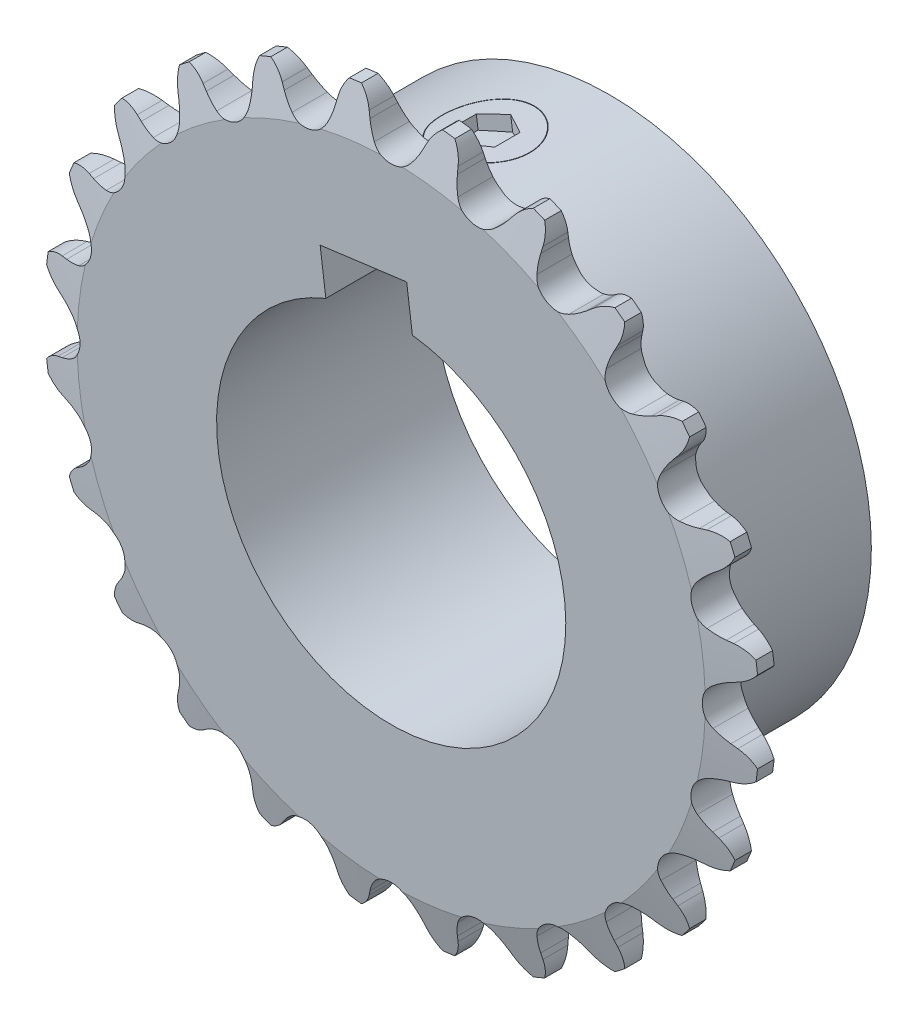
from build123d import *

# Parameters (mm, degrees)
TOOTH_CUT_NUMBER_OF_TEETH_24_DEPTH = 37.826492409
TOOTH_PATTERN_24_24_COUNT          = 24
SKETCH3_W                          = 13.081
SKETCH3_H                          = 19.05
SKETCH4_R                          = 12.7
CUT_EXTRUDE1_DEPTH                 = 40.859801219
CUT_EXTRUDE2_DEPTH                 = 40.859801219
SKETCH7_R                          = 3.175
CUT_EXTRUDE3_DEPTH                 = 52.800976971
CUT_EXTRUDE3_DRAFT                 = 1
EXTRUDE1_REACH                     = 53.801
EXTRUDE1_END_RADIUS                = 19.05
SKETCH8_R                          = 3.20381845
CUT_EXTRUDE4_START                 = -2.54
CUT_EXTRUDE4_DEPTH                 = 50.260976999


with BuildPart() as part:
    # Sprocket-BaseSketch → 25 (04C) ANSI (ISO) Chain Number, 1.915in P.D. (revolve)
    with BuildSketch(Plane(origin=(0, 0, 0), x_dir=(0, 0, -1), z_dir=(1, 0, 0))):
        Polygon((1.397, 0), (1.397, 22.846519308), (0.60325, 26.021519308), (-0.60325, 26.021519308), (-1.397, 22.846519308), (-1.397, 0), align=None)
    revolve(axis=Axis((0, 0, -5.588), (0, 0, 1)))

    # Tooth-Sketch → Tooth-Cut, Number of teeth: 24 (cut, symmetric)
    with BuildSketch(Plane.XY):
        with BuildLine():
            Line((1.931997911, 24.319032161), (2.092325349, 24.719204009))
            ThreePointArc((2.092325349, 24.719204009), (3.079474662, 25.94368443), (4.583251305, 26.404631149))
            ThreePointArc((4.583251305, 26.404631149), (0, 26.799454074), (-4.583251305, 26.404631149))
            ThreePointArc((-4.583251305, 26.404631149), (-3.079474662, 25.94368443), (-2.092325349, 24.719204009))
            Line((-2.092325349, 24.719204009), (-1.931997911, 24.319032161))
            ThreePointArc((-1.931997911, 24.319032161), (-1.674480918, 23.785144178), (-1.346602259, 23.291335547))
            ThreePointArc((-1.346602259, 23.291335547), (0, 22.627264802), (1.346602259, 23.291335547))
            ThreePointArc((1.346602259, 23.291335547), (1.674480918, 23.785144178), (1.931997911, 24.319032161))
        make_face()
    tooth_cut_number_of_teeth_24 = extrude(amount=TOOTH_CUT_NUMBER_OF_TEETH_24_DEPTH, both=True, mode=Mode.SUBTRACT)

    # Tooth Pattern, 24 / 24: Tooth-Cut, Number of teeth: 24 ×24 about axis
    tooth_pattern_24_24_axis = Axis((0, 0, -88.99), (0, 0, 1))
    for i in range(1, TOOTH_PATTERN_24_24_COUNT):
        add(tooth_cut_number_of_teeth_24.rotate(tooth_pattern_24_24_axis, i * 360 / TOOTH_PATTERN_24_24_COUNT), mode=Mode.SUBTRACT)

    # Sketch3 → Hub-Revolve1 (revolve)
    with BuildSketch(Plane(origin=(0, 0, 0), x_dir=(0, 0, -1), z_dir=(1, 0, 0))):
        with Locations((7.9375, 9.525)):
            Rectangle(SKETCH3_W, SKETCH3_H)
    revolve(axis=Axis((0, 0, 13.081), (0, 0, -1)))

    # Sketch4 → Cut-Extrude1 (cut, through all)
    with BuildSketch(Plane(origin=(0, 0, -14.478), x_dir=(-1, 0, 0), z_dir=(0, 0, -1))):
        Circle(SKETCH4_R)
    extrude(amount=-CUT_EXTRUDE1_DEPTH, mode=Mode.SUBTRACT)

    # Sketch6 → Cut-Extrude2 (cut, through all)
    with BuildSketch(Plane(origin=(0, 0, -14.478), x_dir=(-1, 0, 0), z_dir=(0, 0, -1))):
        Polygon((-1.542793119, 12.605942622), (-1.128372459, 15.753780057), (5.167302411, 14.924938736), (4.752881751, 11.777101301), align=None)
    extrude(amount=-CUT_EXTRUDE2_DEPTH, mode=Mode.SUBTRACT)


with BuildPart() as cut_extrude3_tool:
    # Sketch7 → Cut-Extrude3 (with draft: the straight prism first)
    with BuildSketch(Plane(origin=(-2.019464976, 15.339359397, 0), x_dir=(0.9914448613738103, 0.13052619222005268, 0), z_dir=(0.13052619222005268, -0.9914448613738103, 0))):
        with Locations((0, -7.9375)):
            Circle(SKETCH7_R)
    extrude(amount=-CUT_EXTRUDE3_DEPTH)
    # Cut-Extrude3: the draft: its side faces are tilted about the plane it starts from
    cut_extrude3_sides = [cut_extrude3_tool.faces().sort_by_distance(p)[0] for p in [
        (-8.613257646, 41.099567383, -7.9375),
    ]]
    draft(cut_extrude3_sides, Plane(origin=(-2.019464976, 15.339359397, 0), x_dir=(0.9914448613738103, 0.13052619222005268, 0), z_dir=(0.13052619222005268, -0.9914448613738103, 0)), CUT_EXTRUDE3_DRAFT)


with BuildPart() as part_1:
    add(part.part)

    # Cut-Extrude3: cut by cut_extrude3_tool
    add(cut_extrude3_tool.part, mode=Mode.SUBTRACT)

    # Extrude1: up to this cylinder (the profile starts inside it)
    extrude1_end = Plane(origin=(0, 0, -7.9375), z_dir=(0, 0, 1)) * Cylinder(EXTRUDE1_END_RADIUS, 146.702, mode=Mode.PRIVATE)
    # Sketch8 → Extrude1 (add, up to the surface)
    with BuildSketch(Plane(origin=(-2.019464976, 15.339359397, 0), x_dir=(0.9914448613738103, 0.13052619222005268, 0), z_dir=(0.13052619222005268, -0.9914448613738103, 0)), mode=Mode.PRIVATE) as extrude1_sk1:
        with Locations((0, -7.9375)):
            Circle(SKETCH8_R)
    extrude1_tool1 = extrude(extrude1_sk1.sketch, amount=-EXTRUDE1_REACH, mode=Mode.PRIVATE) & extrude1_end
    add(extrude1_tool1.solids().sort_by_distance((-2.019465, 15.339359, -7.9375))[0])

    # Sketch9 → Cut-Extrude4 (cut, through all)
    with BuildSketch(Plane(origin=(-2.019464976, 15.339359397, 0), x_dir=(0.9914448613738103, 0.13052619222005268, 0), z_dir=(0.13052619222005268, -0.9914448613738103, 0)).offset(CUT_EXTRUDE4_START)):
        Polygon((0, -9.787225444), (1.601909225, -8.862362722), (1.601909225, -7.012637278), (0, -6.087774556), (-1.601909225, -7.012637278), (-1.601909225, -8.862362722), align=None)
    extrude(amount=-CUT_EXTRUDE4_DEPTH, mode=Mode.SUBTRACT)


solid = part_1.part
